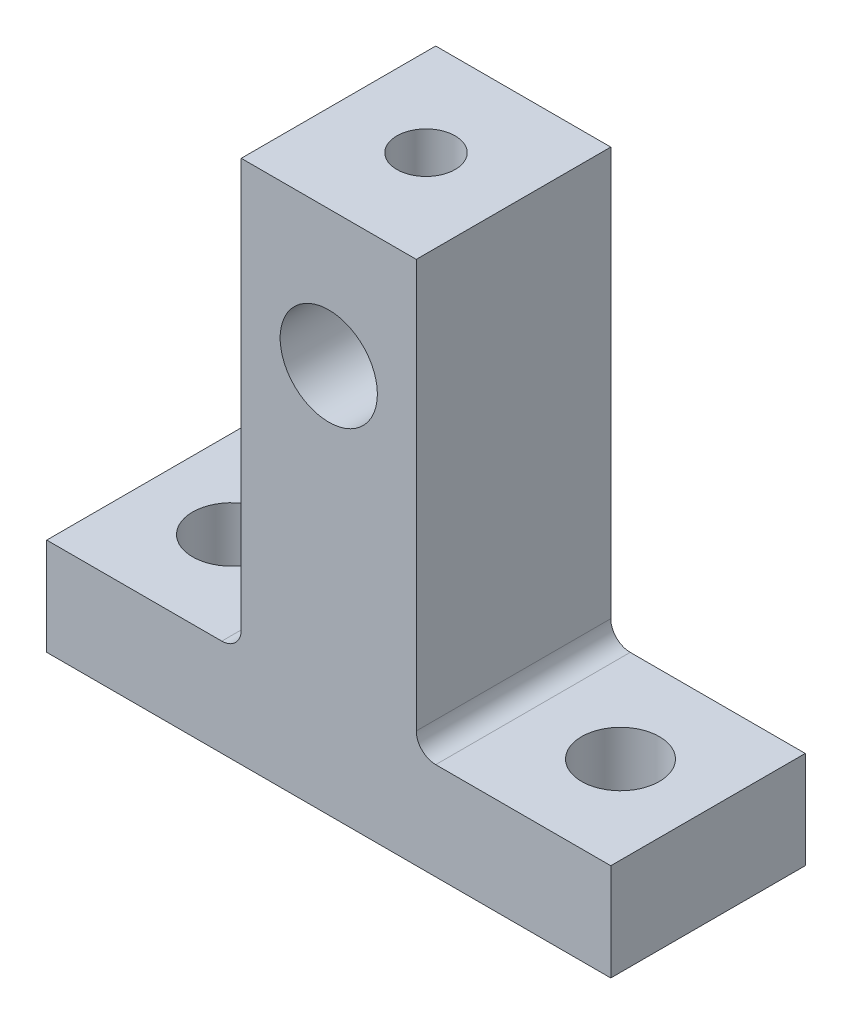
from build123d import *

# Parameters (mm, degrees)
SKETCH1_R               = 2.5
BOSS_EXTRUDE1_DEPTH     = 5
CUT_EXTRUDE1_REACH      = 41.937
CUT_EXTRUDE1_END_RADIUS = 2.5
SKETCH2_R               = 1.5
SKETCH3_R               = 2
CUT_EXTRUDE2_DEPTH      = 37.742346215


with BuildPart() as part:
    # Sketch1 → Boss-Extrude1 (new, symmetric)
    with BuildSketch(Plane.XY):
        with BuildLine():
            Line((0, 0), (29, 0))
            Line((29, 0), (29, 5))
            Line((29, 5), (20, 5))
            ThreePointArc((20, 5), (19.292893219, 5.292893219), (19, 6))
            Line((19, 6), (19, 27))
            Line((19, 27), (10, 27))
            Line((10, 27), (10, 6))
            ThreePointArc((10, 6), (9.707106781, 5.292893219), (9, 5))
            Line((9, 5), (0, 5))
            Line((0, 5), (0, 0))
        make_face()
        with Locations((14.5, 20)):
            Circle(SKETCH1_R, mode=Mode.SUBTRACT)
    extrude(amount=BOSS_EXTRUDE1_DEPTH, both=True)

    # Cut-Extrude1: up to this cylinder (the profile starts outside it)
    cut_extrude1_end = Plane(origin=(14.5, 20, 0), z_dir=(0, 0, -1)) * Cylinder(CUT_EXTRUDE1_END_RADIUS, 89.874, mode=Mode.PRIVATE)
    # Sketch2 → Cut-Extrude1 (cut, up to the surface)
    with BuildSketch(Plane(origin=(0, 27, 0), x_dir=(1, 0, 0), z_dir=(0, 1, 0)), mode=Mode.PRIVATE) as cut_extrude1_sk1:
        with Locations(Location((14.5, 0, 0), (0, 0, 270))):
            Circle(SKETCH2_R)
    cut_extrude1_tool1 = extrude(cut_extrude1_sk1.sketch, amount=-CUT_EXTRUDE1_REACH, mode=Mode.PRIVATE) - cut_extrude1_end
    add(cut_extrude1_tool1.solids().sort_by_distance((14.5, 27, 0))[0], mode=Mode.SUBTRACT)

    # Sketch3 → Cut-Extrude2 (cut, through all)
    with BuildSketch(Plane(origin=(0, 5, 0), x_dir=(1, 0, 0), z_dir=(0, 1, 0))):
        with Locations(Location((4.5, 0, 0), (0, 0, 180))):
            Circle(SKETCH3_R)
        with Locations(Location((24.5, 0, 0), (0, 0, 180))):
            Circle(SKETCH3_R)
    extrude(amount=-CUT_EXTRUDE2_DEPTH, mode=Mode.SUBTRACT)


solid = part.part
